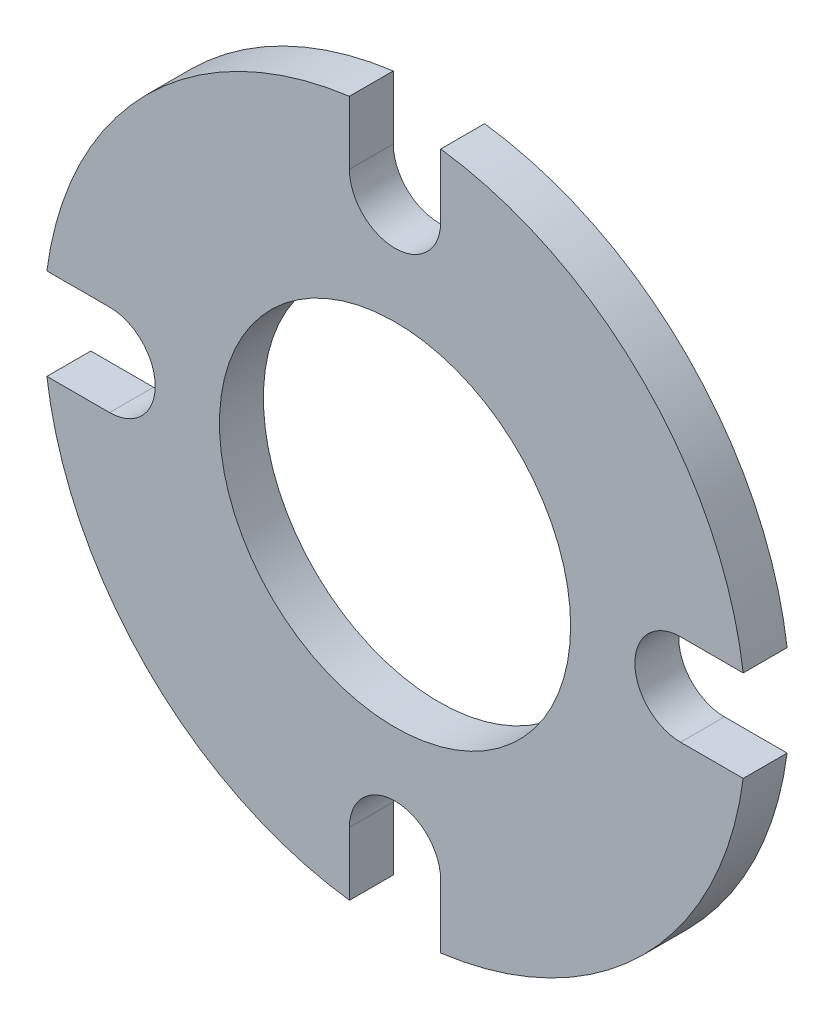
from build123d import *

# Parameters (mm, degrees)
SKETCH1_R           = 0.5
BOSS_EXTRUDE1_DEPTH = 0.0625


with BuildPart() as part:
    # Sketch1 → Boss-Extrude1 (new, symmetric)
    with BuildSketch(Plane.XY):
        with BuildLine():
            Line((0.991513994, 0.13), (0.813, 0.13))
            ThreePointArc((0.813, 0.13), (0.683, 0), (0.813, -0.13))
            Line((0.813, -0.13), (0.991513994, -0.13))
            ThreePointArc((0.991513994, -0.13), (0.707106781, -0.707106781), (0.13, -0.991513994))
            Line((0.13, -0.991513994), (0.13, -0.811513994))
            ThreePointArc((0.13, -0.811513994), (0, -0.681513994), (-0.13, -0.811513994))
            Line((-0.13, -0.811513994), (-0.13, -0.991513994))
            ThreePointArc((-0.13, -0.991513994), (-0.707106781, -0.707106781), (-0.991513994, -0.13))
            Line((-0.991513994, -0.13), (-0.813, -0.13))
            ThreePointArc((-0.813, -0.13), (-0.683, 0), (-0.813, 0.13))
            Line((-0.813, 0.13), (-0.991513994, 0.13))
            ThreePointArc((-0.991513994, 0.13), (-0.707106781, 0.707106781), (-0.13, 0.991513994))
            Line((-0.13, 0.991513994), (-0.13, 0.811513994))
            ThreePointArc((-0.13, 0.811513994), (0, 0.681513994), (0.13, 0.811513994))
            Line((0.13, 0.811513994), (0.13, 0.991513994))
            ThreePointArc((0.13, 0.991513994), (0.707106781, 0.707106781), (0.991513994, 0.13))
        make_face()
        Circle(SKETCH1_R, mode=Mode.SUBTRACT)
    extrude(amount=BOSS_EXTRUDE1_DEPTH, both=True)


solid = part.part
